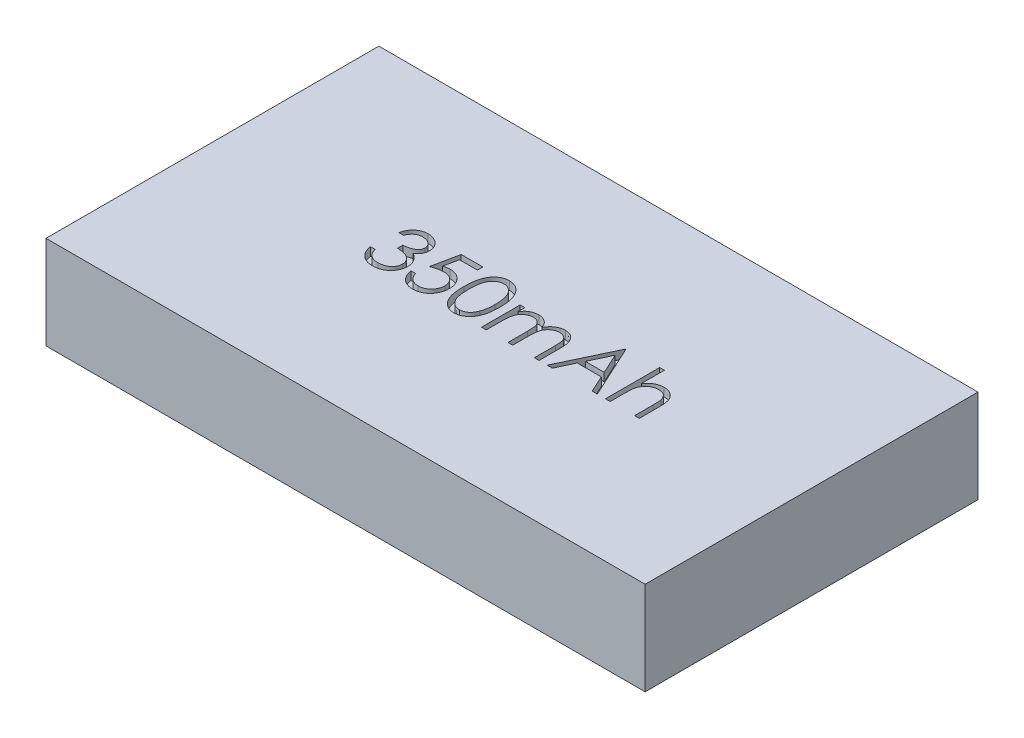
from build123d import *

# Parameters (mm, degrees)
SKETCH1_W           = 36
SKETCH1_H           = 20
BOSS_EXTRUDE1_DEPTH = 5.6
CUT_EXTRUDE1_DEPTH  = 0.5


with BuildPart() as part:
    # Sketch1 → Boss-Extrude1 (new body)
    with BuildSketch(Plane(origin=(0, 0, 0), x_dir=(1, 0, 0), z_dir=(0, 1, 0))):
        with Locations((18, 10)):
            Rectangle(SKETCH1_W, SKETCH1_H)
    extrude(amount=BOSS_EXTRUDE1_DEPTH)

    # Sketch2 → Cut-Extrude1 (cut)
    # profile 1 of 6: a face of its own
    with BuildSketch(Plane(origin=(0, 5.6, 0), x_dir=(1, 0, 0), z_dir=(0, 1, 0))):
        with BuildLine():
            Line((10.586157829, 10.900267723), (10.301221931, 10.900267723))
            add(Edge.make_bspline(
                [(10.301221931, 10.900267723), (10.308941309, 10.932228619), (10.324032062, 10.994709557), (10.355507718, 11.083979), (10.389797042, 11.168455338), (10.430971444, 11.246556776), (10.475882957, 11.319852923), (10.527338569, 11.386681343), (10.582964317, 11.448741676), (10.644491236, 11.503817256), (10.709015093, 11.55368991), (10.777445069, 11.596212284), (10.848404409, 11.632792051), (10.922384751, 11.662927547), (10.999606349, 11.685629272), (11.079371079, 11.702100089), (11.161887968, 11.712796314), (11.217901854, 11.71384022), (11.246344127, 11.714370287)],
                knots=[0, 0, 0, 0, 1.162005537, 2.271625781, 3.343758855, 4.383309926, 5.390229558, 6.379919256, 7.361854164, 8.333198761, 9.295911338, 10.242430842, 11.177959212, 12.116337295, 13.062827104, 14.020064771, 14.994644689, 16, 16, 16, 16], degree=3))
            add(Edge.make_bspline(
                [(11.246344127, 11.714370287), (11.2877849, 11.713119128), (11.369762503, 11.710644101), (11.490197552, 11.688043148), (11.606336167, 11.652278921), (11.716907127, 11.602863469), (11.81961242, 11.541914977), (11.910994532, 11.469375538), (11.989814824, 11.386644743), (12.055940438, 11.295265916), (12.107715616, 11.19760699), (12.145893969, 11.097095419), (12.169136494, 10.993969631), (12.172148713, 10.924339813), (12.173657829, 10.889455423)],
                knots=[0, 0, 0, 0, 1.083050992, 2.142477498, 3.193116406, 4.255571735, 5.30263384, 6.308962982, 7.297363603, 8.282367274, 9.249857812, 10.179914175, 11.08814088, 12, 12, 12, 12], degree=3))
            add(Edge.make_bspline(
                [(12.173657829, 10.889455423), (12.172602285, 10.855884973), (12.170536751, 10.790192813), (12.152998318, 10.694288312), (12.12348328, 10.603899146), (12.082598566, 10.518644806), (12.029674446, 10.439065845), (11.965564214, 10.364983215), (11.88981537, 10.296068336), (11.832412334, 10.256589957), (11.802859551, 10.236265319)],
                knots=[0, 0, 0, 0, 1.024540389, 2.004866551, 2.965041327, 3.920577974, 4.882998113, 5.874504559, 6.905732034, 8, 8, 8, 8], degree=3))
            add(Edge.make_bspline(
                [(11.802859551, 10.236265319), (11.836634072, 10.219956549), (11.903551165, 10.187644159), (11.994764859, 10.124275007), (12.077566932, 10.051108178), (12.123743877, 9.9940102), (12.146945088, 9.965321809)],
                knots=[0, 0, 0, 0, 1.015518401, 2.012035669, 3.001164323, 4, 4, 4, 4], degree=3))
            add(Edge.make_bspline(
                [(12.146945088, 9.965321809), (12.162222592, 9.944405134), (12.192527419, 9.90291431), (12.229933939, 9.836206267), (12.26386935, 9.768758844), (12.290312763, 9.69876424), (12.310790485, 9.627033721), (12.325428171, 9.553444118), (12.334521499, 9.477935341), (12.33582375, 9.426851877), (12.336478341, 9.401174173)],
                knots=[0, 0, 0, 0, 1.025084078, 2.033381695, 3.024893161, 4.013698104, 4.991890475, 5.976764909, 6.982997093, 8, 8, 8, 8], degree=3))
            add(Edge.make_bspline(
                [(12.336478341, 9.401174173), (12.334850461, 9.356715354), (12.331602362, 9.268006941), (12.302570095, 9.136947729), (12.257563798, 9.008836024), (12.193649291, 8.886303848), (12.115755194, 8.771658788), (12.023083907, 8.669082422), (11.91668838, 8.580909403), (11.79802897, 8.507240124), (11.669471289, 8.448350295), (11.531970573, 8.407476757), (11.387508024, 8.380855743), (11.288441404, 8.378001084), (11.238075898, 8.376549774)],
                knots=[0, 0, 0, 0, 0.955779014, 1.907060117, 2.875433937, 3.871313158, 4.872415639, 5.851225146, 6.836215519, 7.83643374, 8.849228613, 9.86973379, 10.916971861, 12, 12, 12, 12], degree=3))
            add(Edge.make_bspline(
                [(11.238075898, 8.376549774), (11.204131247, 8.377337367), (11.137339493, 8.378887089), (11.039147176, 8.389481248), (10.945419635, 8.40883061), (10.856030142, 8.434868609), (10.770899288, 8.467881117), (10.69028685, 8.508991651), (10.613696875, 8.557352799), (10.541852112, 8.613535411), (10.474761126, 8.676383483), (10.414206869, 8.747012728), (10.359179771, 8.824117516), (10.311153234, 8.908593431), (10.267939713, 8.999348772), (10.232396988, 9.097545624), (10.201113651, 9.202306129), (10.186569008, 9.275310937), (10.179106547, 9.312767723)],
                knots=[0, 0, 0, 0, 1.048658725, 2.063410685, 3.046034179, 4.001477787, 4.936774919, 5.862367409, 6.792675028, 7.730719943, 8.675894397, 9.627829632, 10.600096036, 11.597688215, 12.626045268, 13.701542398, 14.82072376, 16, 16, 16, 16], degree=3))
            Line((10.179106547, 9.312767723), (10.464042444, 9.312767723))
            add(Edge.make_bspline(
                [(10.464042444, 9.312767723), (10.471465858, 9.288321118), (10.485905044, 9.240770348), (10.510483443, 9.172335213), (10.538485376, 9.109598979), (10.568525011, 9.052101433), (10.60007403, 8.999276325), (10.635375426, 8.952520487), (10.671814579, 8.909780267), (10.699282278, 8.885700512), (10.712725337, 8.873915559)],
                knots=[0, 0, 0, 0, 1.198163088, 2.33053128, 3.407730985, 4.417276592, 5.372219308, 6.28897303, 7.162600585, 8, 8, 8, 8], degree=3))
            add(Edge.make_bspline(
                [(10.712725337, 8.873915559), (10.730502231, 8.860210142), (10.766001147, 8.832841613), (10.823848042, 8.797915136), (10.884685474, 8.76765192), (10.949831643, 8.744534567), (11.017880756, 8.724960546), (11.089932723, 8.712151218), (11.16535187, 8.703362663), (11.216848342, 8.702587118), (11.243164039, 8.702190799)],
                knots=[0, 0, 0, 0, 0.946170439, 1.889420265, 2.845303464, 3.807233317, 4.801018734, 5.828864929, 6.890507805, 8, 8, 8, 8], degree=3))
            add(Edge.make_bspline(
                [(11.243164039, 8.702190799), (11.272876145, 8.702749513), (11.330975603, 8.703842031), (11.415752511, 8.713889279), (11.496404267, 8.728521868), (11.572035421, 8.751121503), (11.643636667, 8.779044132), (11.710204306, 8.814103757), (11.772612203, 8.855237897), (11.83006102, 8.901991277), (11.881718731, 8.953173633), (11.927202432, 9.006706919), (11.965869089, 9.062365422), (11.997059907, 9.120457146), (12.021689334, 9.180741532), (12.038456238, 9.243387756), (12.050114398, 9.307883133), (12.051063825, 9.351724412), (12.051542444, 9.373825415)],
                knots=[0, 0, 0, 0, 1.217147791, 2.380027433, 3.494444702, 4.572153297, 5.609568379, 6.639424714, 7.649109417, 8.668170816, 9.669597737, 10.625200337, 11.543417969, 12.441394052, 13.322311151, 14.205496177, 15.095365482, 16, 16, 16, 16], degree=3))
            add(Edge.make_bspline(
                [(12.051542444, 9.373825415), (12.050154242, 9.403408558), (12.047384745, 9.462427643), (12.026240534, 9.549257156), (11.991461707, 9.632916966), (11.942773072, 9.711979719), (11.883504232, 9.785255001), (11.814230352, 9.850634131), (11.734376174, 9.904582), (11.660879578, 9.941855281), (11.595778329, 9.967288913), (11.540065802, 9.984229774), (11.47769374, 9.998575019), (11.40941641, 10.011921151), (11.334719349, 10.023279802), (11.25368388, 10.032752021), (11.166293582, 10.040331237), (11.105795167, 10.043715873), (11.074619367, 10.04546003)],
                knots=[0, 0, 0, 0, 1.07054697, 2.135767047, 3.216561865, 4.33974944, 5.486079747, 6.621378074, 7.775625952, 8.963672916, 9.598146892, 10.304877434, 11.070270905, 11.915000392, 12.823868403, 13.805723172, 14.86925407, 16, 16, 16, 16], degree=3))
            Line((11.074619367, 10.04546003), (11.074619367, 10.371101056))
            add(Edge.make_bspline(
                [(11.074619367, 10.371101056), (11.11389971, 10.371767628), (11.190840253, 10.373073278), (11.303230087, 10.388864831), (11.410702306, 10.410709401), (11.510875136, 10.444169539), (11.602177897, 10.483031809), (11.681389251, 10.528254884), (11.747399449, 10.578523978), (11.799887706, 10.634614988), (11.839374935, 10.69477221), (11.868246387, 10.757470892), (11.885300969, 10.823260576), (11.887577595, 10.86815931), (11.888721931, 10.890727458)],
                knots=[0, 0, 0, 0, 1.321986639, 2.589447074, 3.816329219, 5.01088745, 6.139805852, 7.153945165, 8.075214402, 8.924034688, 9.728124013, 10.488707548, 11.240355623, 12, 12, 12, 12], degree=3))
            add(Edge.make_bspline(
                [(11.888721931, 10.890727458), (11.888346001, 10.907307984), (11.887598107, 10.940294154), (11.87816629, 10.988486181), (11.863993053, 11.035204896), (11.84450787, 11.080251624), (11.818427333, 11.123313944), (11.787216188, 11.164758987), (11.750052268, 11.204350129), (11.707466041, 11.24125299), (11.661735332, 11.276422227), (11.611615894, 11.306279598), (11.558618907, 11.33181119), (11.502685699, 11.352865524), (11.443634754, 11.368703592), (11.381743519, 11.380075391), (11.316893978, 11.387185264), (11.272651049, 11.388208898), (11.250160233, 11.388729261)],
                knots=[0, 0, 0, 0, 0.884392785, 1.759457502, 2.611959086, 3.489218968, 4.37281399, 5.2945488, 6.255912374, 7.266815255, 8.301784654, 9.332968512, 10.37626691, 11.440494194, 12.520033166, 13.637162961, 14.798855837, 16, 16, 16, 16], degree=3))
            add(Edge.make_bspline(
                [(11.250160233, 11.388729261), (11.214009077, 11.387467097), (11.143397461, 11.385001797), (11.0416025, 11.363409063), (10.946969962, 11.328957516), (10.8746356, 11.287833991), (10.821220693, 11.247238955), (10.783050899, 11.211785647), (10.745567294, 11.172385871), (10.711235858, 11.126612917), (10.676515894, 11.077566614), (10.644906899, 11.022753703), (10.614191321, 10.963604003), (10.595683293, 10.921788677), (10.586157829, 10.900267723)],
                knots=[0, 0, 0, 0, 1.472543308, 2.876219568, 4.221790263, 5.565193594, 6.249813518, 6.953379497, 7.687249741, 8.463570142, 9.283606569, 10.136032583, 11.040678096, 12, 12, 12, 12], degree=3))
        make_face()
    # profile 2 of 6: a face of its own
    with BuildSketch(Plane(origin=(0, 5.6, 0), x_dir=(1, 0, 0), z_dir=(0, 1, 0))):
        with BuildLine():
            Line((14.615965521, 11.63296003), (14.615965521, 11.307319005))
            Line((14.615965521, 11.307319005), (13.536643606, 11.307319005))
            Line((13.536643606, 11.307319005), (13.364918846, 10.472227859))
            add(Edge.make_bspline(
                [(13.364918846, 10.472227859), (13.398533818, 10.481508177), (13.463657509, 10.499487325), (13.55977824, 10.519449703), (13.651029739, 10.531483355), (13.710243825, 10.533126473), (13.738897212, 10.533921569)],
                knots=[0, 0, 0, 0, 1.100273476, 2.13160584, 3.095893838, 4, 4, 4, 4], degree=3))
            add(Edge.make_bspline(
                [(13.738897212, 10.533921569), (13.774351747, 10.533154184), (13.844064222, 10.531645314), (13.946062409, 10.517156565), (14.043428677, 10.494351071), (14.135959398, 10.462491741), (14.223825755, 10.421752197), (14.306219329, 10.370861537), (14.384376864, 10.311413444), (14.456896217, 10.243064754), (14.522686125, 10.167843002), (14.580530987, 10.086964076), (14.629664194, 10.001213983), (14.669180022, 9.90977343), (14.700734382, 9.813653341), (14.721736549, 9.711842356), (14.735721706, 9.605300132), (14.737284157, 9.532452415), (14.738080906, 9.495304782)],
                knots=[0, 0, 0, 0, 1.052922333, 2.070308379, 3.05430497, 4.020497103, 4.973039431, 5.925935799, 6.892292201, 7.88610001, 8.88166317, 9.857072816, 10.836096531, 11.812156883, 12.81219415, 13.836441305, 14.89672472, 16, 16, 16, 16], degree=3))
            add(Edge.make_bspline(
                [(14.738080906, 9.495304782), (14.737477587, 9.469431053), (14.736279104, 9.418033257), (14.730184385, 9.341702447), (14.718449843, 9.266987591), (14.702694836, 9.193878779), (14.682245643, 9.122514419), (14.657490572, 9.052690248), (14.627195604, 8.984840854), (14.593965714, 8.918324246), (14.556549266, 8.854644172), (14.51502162, 8.795091163), (14.47114721, 8.73877185), (14.423938239, 8.686290249), (14.372955908, 8.637991226), (14.318817652, 8.593588142), (14.261955471, 8.552330078), (14.201489644, 8.515891787), (14.138767535, 8.482361105), (14.072883366, 8.454853325), (14.005336874, 8.430260203), (13.93515588, 8.410657274), (13.86249935, 8.395297028), (13.787247518, 8.384864341), (13.709795053, 8.377265715), (13.657294148, 8.376790049), (13.630774215, 8.376549774)],
                knots=[0, 0, 0, 0, 1.056347294, 2.098418968, 3.122841568, 4.141288669, 5.149314143, 6.15115421, 7.162517403, 8.180376062, 9.185164535, 10.17417709, 11.141909838, 12.097768115, 13.052685741, 14.0056014, 14.954263652, 15.917497458, 16.885230207, 17.854509472, 18.828990115, 19.81800267, 20.826176721, 21.857883937, 22.917946725, 24, 24, 24, 24], degree=3))
            add(Edge.make_bspline(
                [(13.630774215, 8.376549774), (13.599138351, 8.377176463), (13.536898526, 8.378409399), (13.445712012, 8.391307596), (13.357978048, 8.409780577), (13.274402885, 8.437572051), (13.194237524, 8.472394811), (13.118561201, 8.516405909), (13.045440247, 8.56627981), (12.977847186, 8.625135559), (12.915112711, 8.689466214), (12.858954664, 8.759277788), (12.808940634, 8.833418068), (12.765871534, 8.912247108), (12.729134044, 8.995557775), (12.700273304, 9.083662211), (12.676979368, 9.176100072), (12.667124694, 9.239739328), (12.662119367, 9.272062594)],
                knots=[0, 0, 0, 0, 1.0467383, 2.05933395, 3.04377827, 4.011590433, 4.970194871, 5.932262533, 6.905835911, 7.896367577, 8.894135286, 9.877477877, 10.858688626, 11.851381753, 12.8477658, 13.868841284, 14.917554742, 16, 16, 16, 16], degree=3))
            Line((12.662119367, 9.272062594), (12.947055265, 9.272062594))
            add(Edge.make_bspline(
                [(12.947055265, 9.272062594), (12.95406617, 9.241785384), (12.96754152, 9.183590904), (12.997119592, 9.101828902), (13.033283636, 9.028967892), (13.076286152, 8.964044055), (13.127585109, 8.907430179), (13.186122519, 8.856977559), (13.25175224, 8.811461549), (13.324680383, 8.773522324), (13.401617963, 8.741165669), (13.482142503, 8.719619489), (13.564061446, 8.704469393), (13.619468253, 8.702952867), (13.647310673, 8.702190799)],
                knots=[0, 0, 0, 0, 1.136247022, 2.183929868, 3.172523383, 4.106158343, 5.02341133, 5.958108904, 6.928429099, 7.938127109, 8.96079061, 9.975095812, 10.982467395, 12, 12, 12, 12], degree=3))
            add(Edge.make_bspline(
                [(13.647310673, 8.702190799), (13.674487262, 8.702935362), (13.727998188, 8.704401413), (13.806748517, 8.715685373), (13.882778767, 8.733064027), (13.955338727, 8.759071682), (14.025698123, 8.790680819), (14.092077187, 8.831243781), (14.156396225, 8.877925369), (14.216656032, 8.931407455), (14.271846104, 8.990344249), (14.320610585, 9.05337017), (14.361229642, 9.120604738), (14.39545987, 9.190883955), (14.421452505, 9.264978075), (14.439995395, 9.342539855), (14.450883884, 9.423760873), (14.45238174, 9.479159461), (14.453145008, 9.507389117)],
                knots=[0, 0, 0, 0, 1.027316725, 2.022795036, 3.002884548, 3.971462791, 4.93288096, 5.914575861, 6.907176829, 7.935150275, 8.956128384, 9.956726525, 10.942570165, 11.921478529, 12.907843606, 13.90538589, 14.932640048, 16, 16, 16, 16], degree=3))
            add(Edge.make_bspline(
                [(14.453145008, 9.507389117), (14.452547673, 9.532857834), (14.451378475, 9.582709225), (14.441825743, 9.655642791), (14.425209633, 9.724651908), (14.402146542, 9.79006982), (14.372864417, 9.851958229), (14.337080976, 9.910381005), (14.29412468, 9.964568125), (14.245055609, 10.014544941), (14.191300101, 10.060668506), (14.131933277, 10.099987785), (14.068197486, 10.133065767), (14.000860635, 10.161611737), (13.928321049, 10.182113842), (13.852015247, 10.197506138), (13.771119233, 10.206410074), (13.715810109, 10.207645501), (13.687379784, 10.208280543)],
                knots=[0, 0, 0, 0, 1.045622112, 2.046656509, 3.013763289, 3.955457236, 4.890082067, 5.820317437, 6.762574623, 7.722996705, 8.69280354, 9.665887285, 10.63943826, 11.638615906, 12.663482002, 13.728887084, 14.832589034, 16, 16, 16, 16], degree=3))
            add(Edge.make_bspline(
                [(13.687379784, 10.208280543), (13.66276997, 10.207753864), (13.611956947, 10.206666405), (13.534012669, 10.198659512), (13.452105177, 10.185742437), (13.366548456, 10.167974913), (13.277085567, 10.144723865), (13.183905303, 10.116861425), (13.086811747, 10.083549326), (13.021390669, 10.058392246), (12.987760393, 10.04546003)],
                knots=[0, 0, 0, 0, 0.817624296, 1.688186739, 2.600797293, 3.572016777, 4.590301741, 5.671205678, 6.80286297, 8, 8, 8, 8], degree=3))
            Line((12.987760393, 10.04546003), (13.313401418, 11.63296003))
            Line((13.313401418, 11.63296003), (14.615965521, 11.63296003))
        make_face()
    # profile 3 of 6: a face of its own
    with BuildSketch(Plane(origin=(0, 5.6, 0), x_dir=(1, 0, 0), z_dir=(0, 1, 0))):
        with BuildLine():
            add(Edge.make_bspline(
                [(15.063721931, 10.044187995), (15.064019491, 10.09507634), (15.064597504, 10.193927682), (15.071027714, 10.337968036), (15.081709632, 10.473096298), (15.096348534, 10.599318937), (15.114162988, 10.716668538), (15.137944179, 10.824831496), (15.16498865, 10.924308425), (15.196332655, 11.015423712), (15.231700149, 11.099404914), (15.270194086, 11.177804918), (15.313342149, 11.250505099), (15.358678349, 11.318665809), (15.408037871, 11.381171304), (15.460016059, 11.43890429), (15.516641618, 11.490530471), (15.575989633, 11.537562474), (15.638597426, 11.578791637), (15.702680416, 11.61510705), (15.76867969, 11.646131216), (15.836775442, 11.670524682), (15.90635562, 11.690673093), (15.977663459, 11.704451639), (16.050816696, 11.71312112), (16.100193783, 11.713949947), (16.125235353, 11.714370287)],
                knots=[0, 0, 0, 0, 1.646270934, 3.197905019, 4.663502075, 6.030701355, 7.308322542, 8.50163776, 9.611534131, 10.641858119, 11.616356847, 12.558055219, 13.465016945, 14.349605745, 15.204443733, 16.039544428, 16.859896111, 17.680448484, 18.487036065, 19.28249412, 20.06191084, 20.843045899, 21.620316918, 22.403196591, 23.190181807, 24, 24, 24, 24], degree=3))
            add(Edge.make_bspline(
                [(16.125235353, 11.714370287), (16.150486108, 11.713927769), (16.200701916, 11.713047739), (16.274942828, 11.704589592), (16.347468611, 11.690555073), (16.417970065, 11.670669617), (16.487026303, 11.645999253), (16.554097187, 11.615077369), (16.619599325, 11.579082967), (16.6824918, 11.53678845), (16.743465059, 11.4896331), (16.801021425, 11.436326964), (16.855166139, 11.37740829), (16.906578737, 11.313507457), (16.9538006, 11.243398844), (16.998770785, 11.16830183), (17.039022561, 11.086903117), (17.077789016, 11.000560836), (17.111250783, 10.906885945), (17.141428019, 10.806406484), (17.165811084, 10.697935614), (17.186121352, 10.582042449), (17.201855651, 10.458301375), (17.213315262, 10.326977646), (17.219368703, 10.187984863), (17.220508711, 10.092954528), (17.221093726, 10.044187995)],
                knots=[0, 0, 0, 0, 0.810914788, 1.612654377, 2.396697861, 3.181598691, 3.963628158, 4.749916497, 5.551656086, 6.361998678, 7.18212741, 8.025565596, 8.878627764, 9.750805457, 10.657531673, 11.591944965, 12.560506719, 13.57287815, 14.630710178, 15.753379473, 16.941251878, 18.199788006, 19.531962791, 20.947069417, 22.433333509, 24, 24, 24, 24], degree=3))
            add(Edge.make_bspline(
                [(17.221093726, 10.044187995), (17.220502646, 9.995634164), (17.21935095, 9.901029005), (17.213383123, 9.76266162), (17.201627793, 9.632034824), (17.186923018, 9.508835333), (17.166556788, 9.393575921), (17.141514958, 9.285857743), (17.113710737, 9.185215621), (17.079389174, 9.092474042), (17.041823744, 9.006339265), (17.000952244, 8.925905495), (16.957164616, 8.850461786), (16.909459112, 8.780612016), (16.858610658, 8.715861377), (16.80353095, 8.657352819), (16.745772634, 8.603676567), (16.684619942, 8.555914019), (16.620746606, 8.514108518), (16.555469444, 8.476721668), (16.487630232, 8.446574866), (16.418766339, 8.420689507), (16.347892749, 8.400913383), (16.275097809, 8.387239242), (16.200751795, 8.377649066), (16.150494661, 8.376917473), (16.125235353, 8.376549774)],
                knots=[0, 0, 0, 0, 1.561518951, 3.042555995, 4.452378317, 5.7783523, 7.031515105, 8.214008947, 9.334062868, 10.386615937, 11.391082383, 12.354592575, 13.286541444, 14.194233754, 15.072674879, 15.931287219, 16.775624067, 17.606195743, 18.42308326, 19.229000347, 20.022332153, 20.807536673, 21.593273796, 22.3848459, 23.188221202, 24, 24, 24, 24], degree=3))
            add(Edge.make_bspline(
                [(16.125235353, 8.376549774), (16.100194478, 8.376972825), (16.05081876, 8.377806999), (15.977655489, 8.386437312), (15.906642129, 8.400312519), (15.83742826, 8.419740438), (15.769658778, 8.44352104), (15.704257147, 8.47450331), (15.640496176, 8.51018493), (15.578545979, 8.550820776), (15.519570662, 8.597376875), (15.463238355, 8.648870194), (15.410964231, 8.706585717), (15.362310444, 8.769612118), (15.316069664, 8.83736956), (15.273534304, 8.910783155), (15.234190744, 8.989561809), (15.198228434, 9.074214485), (15.166343575, 9.165976455), (15.138178869, 9.265897496), (15.115941026, 9.374859537), (15.096906488, 9.491987434), (15.081553654, 9.6177845), (15.071072231, 9.752319027), (15.064594038, 9.895507181), (15.064017938, 9.993723333), (15.063721931, 10.044187995)],
                knots=[0, 0, 0, 0, 0.810891512, 1.598919785, 2.382837074, 3.152667961, 3.926044502, 4.706494248, 5.493654104, 6.291793342, 7.103789334, 7.925228297, 8.761435821, 9.622817696, 10.50288917, 11.416980706, 12.369136599, 13.353924996, 14.394355917, 15.514179734, 16.714354668, 17.994756427, 19.357759367, 20.818452758, 22.365282078, 24, 24, 24, 24], degree=3))
        make_face()
        with BuildLine():
            add(Edge.make_bspline(
                [(15.348657829, 10.04546003), (15.348766184, 10.003052282), (15.348976481, 9.92074717), (15.35447032, 9.801146497), (15.361954459, 9.689594842), (15.371607636, 9.585950563), (15.385943168, 9.49056448), (15.402005754, 9.402780553), (15.421552949, 9.323063345), (15.444680573, 9.250865831), (15.471023182, 9.184962747), (15.49978493, 9.123638788), (15.530682871, 9.066169531), (15.565262387, 9.013071187), (15.60292248, 8.964170595), (15.642812508, 8.91860224), (15.686421209, 8.877964978), (15.746749604, 8.829227046), (15.826393549, 8.77886326), (15.926742104, 8.73500645), (16.029855628, 8.707445222), (16.099842833, 8.703940243), (16.134775617, 8.702190799)],
                knots=[0, 0, 0, 0, 1.459021318, 2.831673884, 4.118529203, 5.306027144, 6.411944654, 7.436330062, 8.375795394, 9.233974572, 10.042671642, 10.816086306, 11.563610507, 12.285937304, 12.993564865, 13.685989202, 14.367179055, 15.041617293, 16.353048772, 17.594441528, 18.799311195, 20, 20, 20, 20], degree=3))
            add(Edge.make_bspline(
                [(16.134775617, 8.702190799), (16.169934362, 8.703640215), (16.240179262, 8.706536053), (16.342807777, 8.734474908), (16.442439522, 8.776629419), (16.520519067, 8.826474656), (16.579921089, 8.873943926), (16.622481502, 8.914415786), (16.661544931, 8.959732894), (16.698594528, 9.008627255), (16.732575261, 9.062033009), (16.763475393, 9.119693345), (16.791672429, 9.181768385), (16.807737064, 9.225102362), (16.815950497, 9.247257907)],
                knots=[0, 0, 0, 0, 1.353760809, 2.704726607, 4.075137775, 5.516104923, 6.260822281, 7.007110065, 7.778089737, 8.566572457, 9.372053459, 10.217411131, 11.088608312, 12, 12, 12, 12], degree=3))
            add(Edge.make_bspline(
                [(16.815950497, 9.247257907), (16.825522458, 9.275587742), (16.844957643, 9.333109457), (16.870005467, 9.422339341), (16.889731651, 9.515958991), (16.907478418, 9.613408918), (16.919591547, 9.71540779), (16.929341349, 9.82164001), (16.935084187, 9.932185674), (16.935796068, 10.007292559), (16.936157829, 10.04546003)],
                knots=[0, 0, 0, 0, 0.884706709, 1.796334032, 2.740027952, 3.714592787, 4.726048262, 5.777819803, 6.87074269, 8, 8, 8, 8], degree=3))
            add(Edge.make_bspline(
                [(16.936157829, 10.04546003), (16.935658728, 10.083621328), (16.934682382, 10.158272985), (16.930950407, 10.267600191), (16.921313307, 10.371438803), (16.910609821, 10.470236161), (16.894828056, 10.563445364), (16.877812046, 10.651846712), (16.854950946, 10.734345027), (16.830530864, 10.812231934), (16.802581434, 10.884622527), (16.771815018, 10.951854319), (16.738956708, 11.014251891), (16.703267676, 11.071644045), (16.665171592, 11.124287852), (16.623662958, 11.171127806), (16.580388277, 11.213615627), (16.519775544, 11.262113814), (16.440423867, 11.31156371), (16.341685315, 11.35707122), (16.23893266, 11.383204457), (16.169469598, 11.386888988), (16.134775617, 11.388729261)],
                knots=[0, 0, 0, 0, 1.31362396, 2.569729283, 3.763502607, 4.902122613, 5.988968491, 7.01645872, 7.998833611, 8.933434873, 9.825090667, 10.667526885, 11.477055099, 12.250526234, 12.991942729, 13.710640831, 14.402115721, 15.076753259, 16.378508321, 17.609869233, 18.806226677, 20, 20, 20, 20], degree=3))
            add(Edge.make_bspline(
                [(16.134775617, 11.388729261), (16.09965958, 11.386886449), (16.029363533, 11.383197467), (15.925542888, 11.357168587), (15.826025369, 11.311799682), (15.746883528, 11.26195003), (15.686228522, 11.214471704), (15.643517793, 11.173299707), (15.603470908, 11.128263462), (15.566579494, 11.078913153), (15.532027073, 11.025876713), (15.500294297, 10.968736905), (15.471703577, 10.907204167), (15.445319747, 10.841330687), (15.422121575, 10.769139401), (15.402986337, 10.689520386), (15.385308796, 10.60201567), (15.372794517, 10.506112973), (15.361669538, 10.402442734), (15.35452003, 10.290612595), (15.348958103, 10.170811336), (15.348759925, 10.088080671), (15.348657829, 10.04546003)],
                knots=[0, 0, 0, 0, 1.207732386, 2.417664972, 3.655092373, 4.956220595, 5.625982001, 6.301752483, 6.994047911, 7.697131622, 8.419323945, 9.170223765, 9.943494443, 10.752040957, 11.610060368, 12.549350801, 13.567764191, 14.679664412, 15.874934091, 17.154273443, 18.533957287, 20, 20, 20, 20], degree=3))
        make_face(mode=Mode.SUBTRACT)
    # profile 4 of 6: a face of its own
    with BuildSketch(Plane(origin=(0, 5.6, 0), x_dir=(1, 0, 0), z_dir=(0, 1, 0))):
        with BuildLine():
            Line((17.709555265, 10.778152338), (17.994491162, 10.778152338))
            Line((17.994491162, 10.778152338), (17.994491162, 10.374917162))
            add(Edge.make_bspline(
                [(17.994491162, 10.374917162), (18.020148745, 10.410193772), (18.069311134, 10.477787139), (18.149924976, 10.566859754), (18.230457592, 10.642450294), (18.288454303, 10.682131328), (18.316316082, 10.701194205)],
                knots=[0, 0, 0, 0, 1.134379233, 2.173579362, 3.122582517, 4, 4, 4, 4], degree=3))
            add(Edge.make_bspline(
                [(18.316316082, 10.701194205), (18.354293311, 10.719341929), (18.429584263, 10.755320315), (18.548800274, 10.791817901), (18.67078801, 10.8142471), (18.753164033, 10.817314489), (18.794601338, 10.818857466)],
                knots=[0, 0, 0, 0, 1.014936303, 2.012140481, 3.000054389, 4, 4, 4, 4], degree=3))
            add(Edge.make_bspline(
                [(18.794601338, 10.818857466), (18.822625699, 10.817909238), (18.878084403, 10.816032746), (18.960257114, 10.803822571), (19.039957426, 10.782716828), (19.116714438, 10.753318756), (19.189032483, 10.717716404), (19.255334827, 10.67594274), (19.314865358, 10.629046108), (19.367593991, 10.57490879), (19.415009464, 10.51201059), (19.458623846, 10.438655164), (19.49892386, 10.353195357), (19.521258904, 10.291177138), (19.533017805, 10.258525936)],
                knots=[0, 0, 0, 0, 1.009824226, 1.998387844, 2.986035974, 3.974953746, 4.955485308, 5.885931332, 6.793869504, 7.679848016, 8.601185859, 9.625726857, 10.749998409, 12, 12, 12, 12], degree=3))
            add(Edge.make_bspline(
                [(19.533017805, 10.258525936), (19.545455868, 10.280954516), (19.569932231, 10.325090812), (19.611030916, 10.387555093), (19.654090989, 10.445981254), (19.699479422, 10.500415654), (19.747036011, 10.55058948), (19.796984567, 10.59666862), (19.849040762, 10.638850956), (19.921423722, 10.688129823), (20.015596587, 10.740473037), (20.134330806, 10.785855983), (20.257838461, 10.813901328), (20.341674516, 10.817194504), (20.384009391, 10.818857466)],
                knots=[0, 0, 0, 0, 0.86119277, 1.694706429, 2.50939023, 3.298075842, 4.073795165, 4.829715201, 5.57930267, 6.321991688, 7.768977793, 9.186738141, 10.579381044, 12, 12, 12, 12], degree=3))
            add(Edge.make_bspline(
                [(20.384009391, 10.818857466), (20.422909004, 10.817390416), (20.499039323, 10.814519256), (20.609871557, 10.791973605), (20.713233052, 10.753258882), (20.808915828, 10.700432655), (20.895239373, 10.634048681), (20.970274882, 10.555064807), (21.033566569, 10.464039713), (21.074912906, 10.378412695), (21.102957467, 10.302815643), (21.12024873, 10.238402793), (21.135524739, 10.16750817), (21.148207726, 10.090047004), (21.157477412, 10.005745667), (21.164345133, 9.914742115), (21.168993399, 9.816965621), (21.169321851, 9.749505489), (21.169491162, 9.714730864)],
                knots=[0, 0, 0, 0, 1.209669288, 2.367440248, 3.500751976, 4.631527125, 5.755587489, 6.87532382, 8.007944318, 9.190864318, 9.82315674, 10.514484317, 11.263564316, 12.079023757, 12.955305781, 13.901327259, 14.918167583, 16, 16, 16, 16], degree=3))
            Line((21.169491162, 9.714730864), (21.169491162, 8.45796003))
            Line((21.169491162, 8.45796003), (20.884555265, 8.45796003))
            Line((20.884555265, 8.45796003), (20.884555265, 9.716002899))
            add(Edge.make_bspline(
                [(20.884555265, 9.716002899), (20.884484614, 9.745685134), (20.884348833, 9.802729875), (20.881905325, 9.884601742), (20.87730129, 9.959230894), (20.871917724, 10.026515574), (20.864439412, 10.086612689), (20.854782031, 10.139401526), (20.844551564, 10.185297341), (20.827555343, 10.236175398), (20.800388327, 10.292300518), (20.759006756, 10.352828333), (20.70687316, 10.405515916), (20.646675018, 10.451252532), (20.578141786, 10.488439621), (20.502608787, 10.514997144), (20.420544969, 10.531437184), (20.363737154, 10.533075498), (20.334400016, 10.533921569)],
                knots=[0, 0, 0, 0, 1.253487763, 2.409012846, 3.458416907, 4.410876679, 5.259312806, 6.014470957, 6.676830364, 7.243083969, 8.276244668, 9.299465089, 10.325150304, 11.392391894, 12.482080715, 13.603491619, 14.762376348, 16, 16, 16, 16], degree=3))
            add(Edge.make_bspline(
                [(20.334400016, 10.533921569), (20.2984137, 10.532636912), (20.22729106, 10.530097941), (20.123472654, 10.504177356), (20.023713232, 10.465097414), (19.930989504, 10.408462257), (19.845692866, 10.340600384), (19.772305392, 10.259910394), (19.711679052, 10.168624674), (19.670627231, 10.084127308), (19.64469265, 10.00822717), (19.627568591, 9.941917411), (19.614248657, 9.86655056), (19.60175682, 9.782633051), (19.593603667, 9.689587244), (19.586193786, 9.587843552), (19.582727718, 9.47709596), (19.582242887, 9.400327464), (19.581991162, 9.360469045)],
                knots=[0, 0, 0, 0, 1.090531906, 2.155305635, 3.229839962, 4.33261226, 5.44038871, 6.529323825, 7.629011124, 8.757537029, 9.370236727, 10.061839251, 10.834451254, 11.692844982, 12.636905849, 13.66920014, 14.789842145, 16, 16, 16, 16], degree=3))
            Line((19.581991162, 9.360469045), (19.581991162, 8.45796003))
            Line((19.581991162, 8.45796003), (19.297055265, 8.45796003))
            Line((19.297055265, 8.45796003), (19.297055265, 9.637772731))
            add(Edge.make_bspline(
                [(19.297055265, 9.637772731), (19.296983209, 9.671058813), (19.296844582, 9.735097889), (19.29441678, 9.826931294), (19.289802488, 9.910461988), (19.28446799, 9.985592888), (19.2767934, 10.05218745), (19.268075973, 10.110602695), (19.257781162, 10.160692176), (19.240736052, 10.215631818), (19.214687927, 10.276157227), (19.172788575, 10.340692296), (19.12053027, 10.397178356), (19.059233833, 10.445400935), (18.990285821, 10.485262136), (18.914100879, 10.513982054), (18.831364994, 10.530695516), (18.774325932, 10.532825938), (18.744991963, 10.533921569)],
                knots=[0, 0, 0, 0, 1.320475261, 2.540461679, 3.643808994, 4.639130445, 5.527981419, 6.302341397, 6.981980563, 7.553956391, 8.582137848, 9.585246428, 10.591171744, 11.620968678, 12.668337649, 13.738356861, 14.836885341, 16, 16, 16, 16], degree=3))
            add(Edge.make_bspline(
                [(18.744991963, 10.533921569), (18.710505829, 10.532533223), (18.641776187, 10.529766299), (18.5408094, 10.50486135), (18.44330453, 10.465850511), (18.350817053, 10.411730532), (18.265841219, 10.344693511), (18.191448005, 10.265849284), (18.128907285, 10.17617909), (18.087421996, 10.092572707), (18.060662666, 10.018574093), (18.042886898, 9.955662876), (18.027610952, 9.885812651), (18.016258946, 9.808807914), (18.005300284, 9.725150208), (18.00001136, 9.634422778), (17.994866443, 9.536703455), (17.994619324, 9.469236932), (17.994491162, 9.43424709)],
                knots=[0, 0, 0, 0, 1.098833095, 2.189935336, 3.297829714, 4.440610912, 5.596351641, 6.740013378, 7.886572111, 9.072425424, 9.705826452, 10.395263256, 11.156850408, 11.985370555, 12.878090359, 13.847760091, 14.883794034, 16, 16, 16, 16], degree=3))
            Line((17.994491162, 9.43424709), (17.994491162, 8.45796003))
            Line((17.994491162, 8.45796003), (17.709555265, 8.45796003))
            Line((17.709555265, 8.45796003), (17.709555265, 10.778152338))
        make_face()
    # profile 5 of 6: a face of its own
    with BuildSketch(Plane(origin=(0, 5.6, 0), x_dir=(1, 0, 0), z_dir=(0, 1, 0))):
        Polygon((23.204747572, 11.63296003), (24.670132188, 8.45796003), (24.360391603, 8.45796003), (23.891010593, 9.475588235), (22.4517027, 9.475588235), (21.969601338, 8.45796003), (21.6579527, 8.45796003), (23.164042444, 11.63296003), align=None)
        Polygon((23.18121492, 11.01347886), (22.606891002, 9.801229261), (23.740910433, 9.801229261), align=None, mode=Mode.SUBTRACT)
    # profile 6 of 6: a face of its own
    with BuildSketch(Plane(origin=(0, 5.6, 0), x_dir=(1, 0, 0), z_dir=(0, 1, 0))):
        with BuildLine():
            Line((25.158593726, 11.714370287), (25.443529624, 11.714370287))
            Line((25.443529624, 11.714370287), (25.443529624, 10.339936192))
            add(Edge.make_bspline(
                [(25.443529624, 10.339936192), (25.474116033, 10.378166804), (25.533669339, 10.452603766), (25.633905102, 10.54972356), (25.736839393, 10.633905167), (25.846027471, 10.700916224), (25.959466157, 10.753853946), (26.077633892, 10.791398453), (26.20055263, 10.814486234), (26.284032587, 10.817387656), (26.326322091, 10.818857466)],
                knots=[0, 0, 0, 0, 1.125788106, 2.19196713, 3.20547328, 4.180437432, 5.132270164, 6.079753143, 7.027236121, 8, 8, 8, 8], degree=3))
            add(Edge.make_bspline(
                [(26.326322091, 10.818857466), (26.369257519, 10.817274112), (26.453292508, 10.814175105), (26.575649263, 10.789670109), (26.689913771, 10.747798719), (26.795746357, 10.690497203), (26.890837333, 10.61912971), (26.975065333, 10.536732543), (27.043863772, 10.44123406), (27.090671542, 10.353008744), (27.121127419, 10.274505731), (27.140405862, 10.20716261), (27.156751849, 10.132122017), (27.170993752, 10.049422581), (27.180485715, 9.958667318), (27.188109905, 9.860265673), (27.193531402, 9.754223288), (27.193741501, 9.680817061), (27.193850136, 9.642860872)],
                knots=[0, 0, 0, 0, 1.235656852, 2.418478516, 3.575258207, 4.727955599, 5.870717718, 6.98870536, 8.107142894, 9.245821548, 9.854588956, 10.528768408, 11.260415777, 12.065282286, 12.943670737, 13.886611085, 14.907229059, 16, 16, 16, 16], degree=3))
            Line((27.193850136, 9.642860872), (27.193850136, 8.45796003))
            Line((27.193850136, 8.45796003), (26.908914239, 8.45796003))
            Line((26.908914239, 8.45796003), (26.908914239, 9.54936628))
            add(Edge.make_bspline(
                [(26.908914239, 9.54936628), (26.908741607, 9.580955416), (26.908411391, 9.641380057), (26.907319785, 9.727890741), (26.904883004, 9.806355092), (26.900945255, 9.876521641), (26.896803869, 9.93848821), (26.891104003, 9.992164809), (26.884472576, 10.037625162), (26.878513753, 10.06498879), (26.875841322, 10.077260912)],
                knots=[0, 0, 0, 0, 1.430932559, 2.737130458, 3.918967929, 4.986496826, 5.920444988, 6.731744033, 7.431208747, 8, 8, 8, 8], degree=3))
            add(Edge.make_bspline(
                [(26.875841322, 10.077260912), (26.8654779, 10.113269279), (26.845554281, 10.182495157), (26.799246473, 10.276531771), (26.741407942, 10.356709358), (26.670789354, 10.421945891), (26.588639981, 10.473119216), (26.494424156, 10.508559275), (26.389028609, 10.530555423), (26.314777631, 10.53276822), (26.276076699, 10.533921569)],
                knots=[0, 0, 0, 0, 1.090059168, 2.095632401, 3.037101401, 3.955032261, 4.878929692, 5.839099886, 6.873700383, 8, 8, 8, 8], degree=3))
            add(Edge.make_bspline(
                [(26.276076699, 10.533921569), (26.253155219, 10.533489926), (26.207794202, 10.532635717), (26.14053077, 10.52405968), (26.075280834, 10.510045486), (26.011416001, 10.491082083), (25.950289814, 10.465277918), (25.890120548, 10.435405531), (25.832612944, 10.398840186), (25.77674581, 10.357813954), (25.724750619, 10.312393529), (25.676375308, 10.264453791), (25.633251242, 10.21340436), (25.594181877, 10.160064254), (25.560455861, 10.103701842), (25.531016279, 10.044860638), (25.506037469, 9.983463263), (25.493625312, 9.940850172), (25.48741484, 9.91952854)],
                knots=[0, 0, 0, 0, 1.024319606, 2.027102035, 3.025350316, 4.005802111, 5.00026367, 5.987881639, 7.005602596, 8.042517216, 9.083927026, 10.089214625, 11.084353441, 12.06828073, 13.041928858, 14.016821737, 15.00770877, 16, 16, 16, 16], degree=3))
            add(Edge.make_bspline(
                [(25.48741484, 9.91952854), (25.483841217, 9.904088106), (25.476053852, 9.8704415), (25.467603967, 9.814947649), (25.460040395, 9.750462154), (25.453646353, 9.677082824), (25.449724696, 9.594540768), (25.445499006, 9.503399255), (25.443926008, 9.403087379), (25.4436657, 9.333332169), (25.443529624, 9.296867282)],
                knots=[0, 0, 0, 0, 0.607992626, 1.324890765, 2.152360218, 3.099583803, 4.150613268, 5.323148443, 6.60066238, 8, 8, 8, 8], degree=3))
            Line((25.443529624, 9.296867282), (25.443529624, 8.45796003))
            Line((25.443529624, 8.45796003), (25.158593726, 8.45796003))
            Line((25.158593726, 8.45796003), (25.158593726, 11.714370287))
        make_face()
    extrude(amount=-CUT_EXTRUDE1_DEPTH, mode=Mode.SUBTRACT)


solid = part.part
